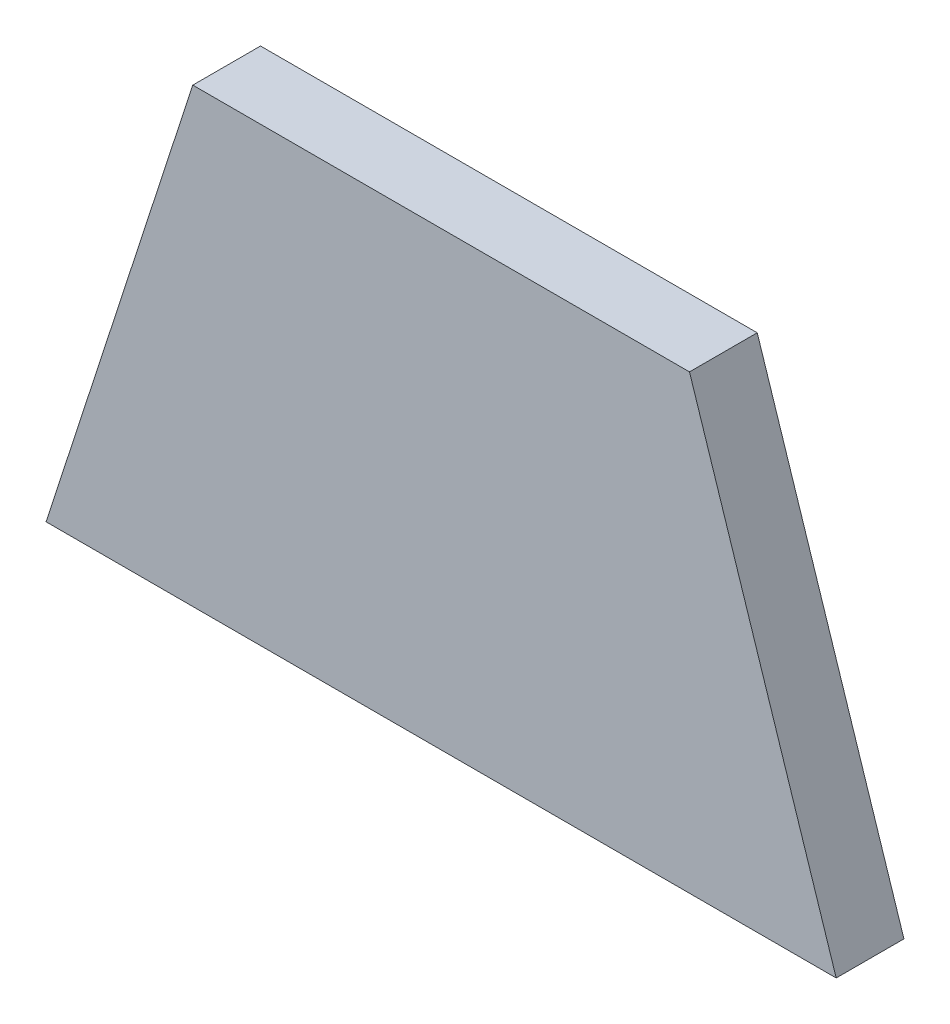
from build123d import *

# Parameters (mm, degrees)
BOSS_EXTRU_1_DEPTH = 15


with BuildPart() as part:
    # Esquisse1 → Boss.-Extru.1 (new body)
    with BuildSketch(Plane.XY):
        Polygon((0, 0), (174.983939247, 0), (142.491969623, 100), (32.491969623, 100), align=None)
    extrude(amount=BOSS_EXTRU_1_DEPTH)


solid = part.part
